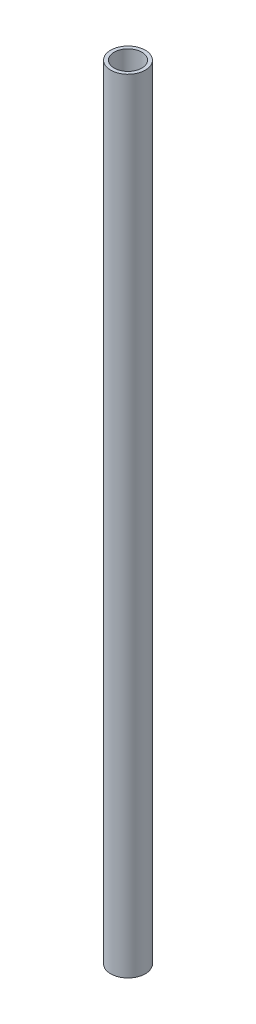
from build123d import *

# Parameters (mm, degrees)
SKETCH1_R           = 10
SKETCH1_R_2         = 8
BOSS_EXTRUDE1_DEPTH = 452


with BuildPart() as part:
    # Sketch1 → Boss-Extrude1 (new body)
    with BuildSketch(Plane(origin=(0, 0, 0), x_dir=(1, 0, 0), z_dir=(0, 1, 0))):
        with Locations(Location((0, 0, 0), (0, 0, 270))):
            Circle(SKETCH1_R)
        with Locations(Location((0, 0, 0), (0, 0, 270))):
            Circle(SKETCH1_R_2, mode=Mode.SUBTRACT)
    extrude(amount=BOSS_EXTRUDE1_DEPTH)


solid = part.part
